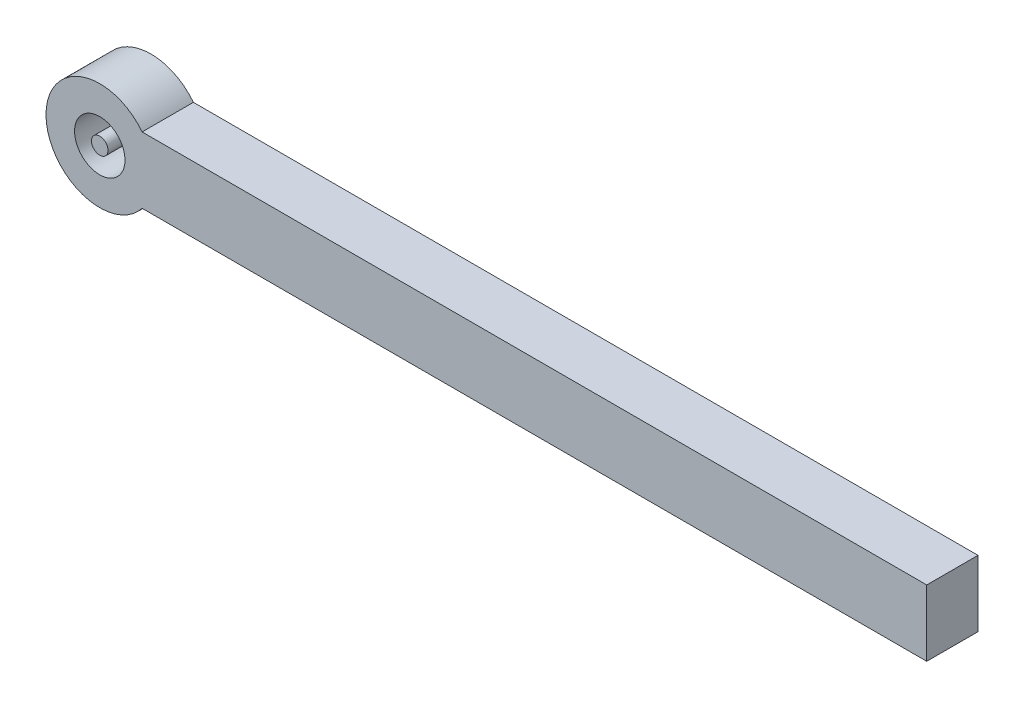
from build123d import *

# Parameters (mm, degrees)
SKETCH_1_R        = 3.05
EXTRUDE_1_DEPTH   = 4.2
SKETCH_1_R_2      = 1
EXTRUDE_1_2_DEPTH = 4.2
EXTRUDE_START     = -2
EXTRUDE_2_DEPTH   = 2


with BuildPart() as part:
    # 草图1 → 凸台-拉伸1 (new body)
    with BuildSketch(Plane.XY):
        with BuildLine():
            Line((100, 4), (5.123475383, 4))
            ThreePointArc((5.123475383, 4), (-6.5, 0), (5.123475383, -4))
            Line((5.123475383, -4), (100, -4))
            Line((100, -4), (100, 4))
        make_face()
        Circle(SKETCH_1_R, mode=Mode.SUBTRACT)
    extrude(amount=EXTRUDE_1_DEPTH)



with BuildPart() as body_2:
    # 草图1 → Extrude 1 2 (new body)
    with BuildSketch(Plane.XY):
        Circle(SKETCH_1_R_2)
    extrude(amount=EXTRUDE_1_2_DEPTH)


with BuildPart() as part_1:
    add(part.part)

    add(body_2.part)  # 凸台-拉伸2 merges body 2
    # 草图1<4> → 凸台-拉伸2 (add)
    with BuildSketch(Plane.XY.offset(EXTRUDE_START)):
        with BuildLine():
            Line((100, 4), (5.123475383, 4))
            ThreePointArc((5.123475383, 4), (-6.5, 0), (5.123475383, -4))
            Line((5.123475383, -4), (100, -4))
            Line((100, -4), (100, 4))
        make_face()
    extrude(amount=EXTRUDE_2_DEPTH)


solid = part_1.part
